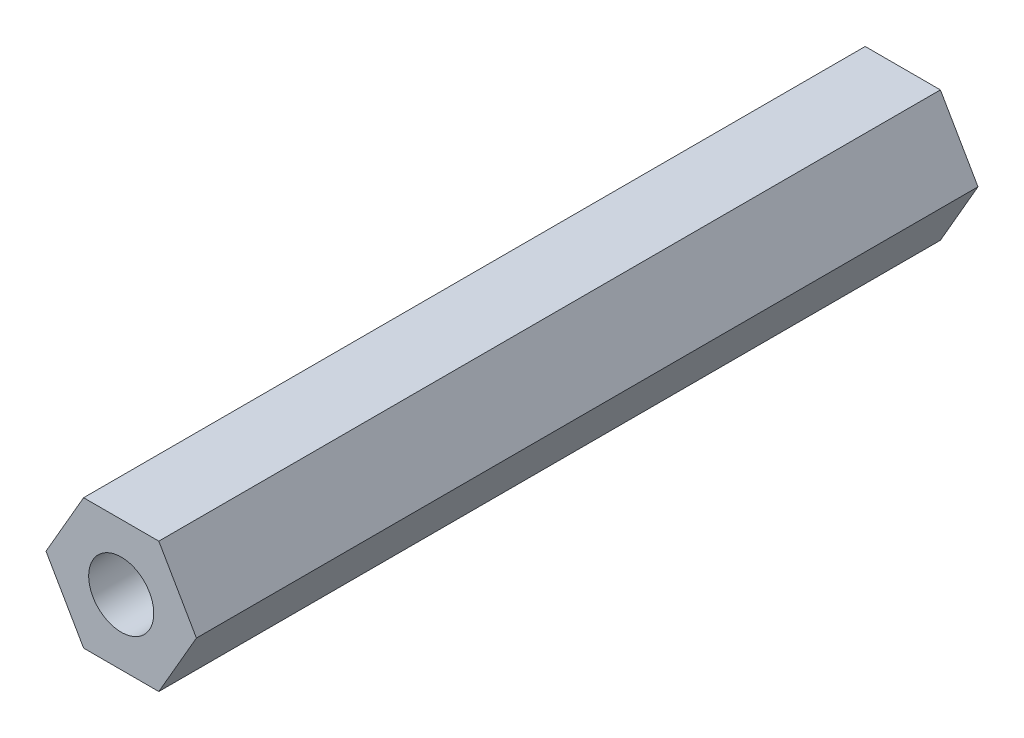
from build123d import *

# Parameters (mm, degrees)
SKETCH1_R           = 3.175
BOSS_EXTRUDE1_DEPTH = 76.2


with BuildPart() as part:
    # Sketch1 → Boss-Extrude1 (new body)
    with BuildSketch(Plane.XY):
        Polygon((3.666174209, 6.35), (-3.666174209, 6.35), (-7.332348419, 0), (-3.666174209, -6.35), (3.666174209, -6.35), (7.332348419, 0), align=None)
        with Locations(Location((0, 0, 0), (0, 0, 180))):
            Circle(SKETCH1_R, mode=Mode.SUBTRACT)
    extrude(amount=BOSS_EXTRUDE1_DEPTH)


solid = part.part
